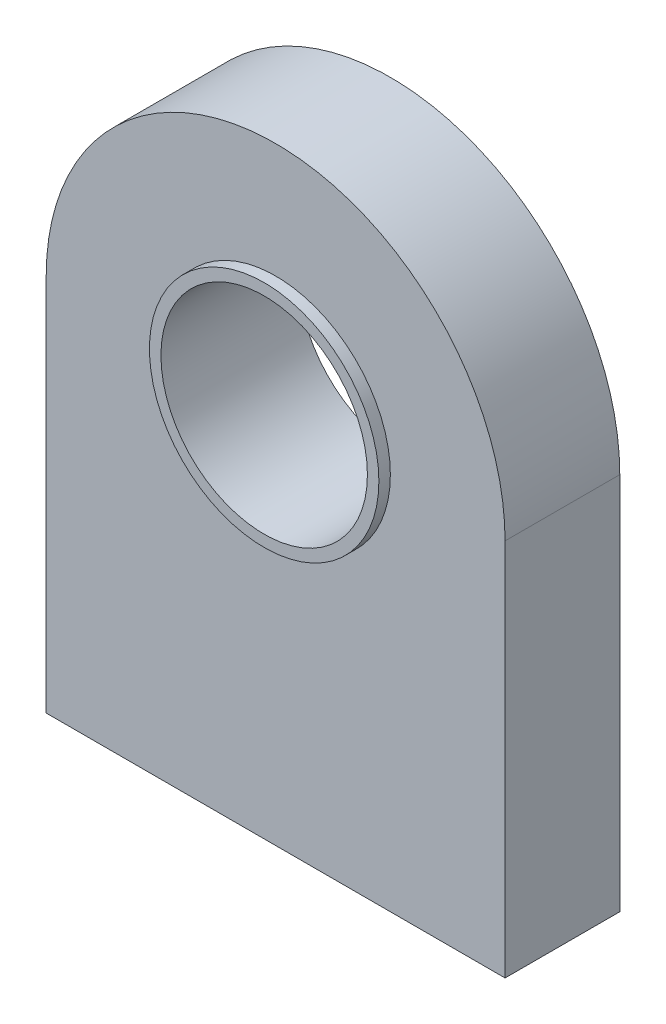
from build123d import *

# Parameters (mm, degrees)
CROQUIS1_R                   = 4.5
SALIENTE_EXTRUIR1_DEPTH      = 5
SALIENTE_EXTRUIR3_DEPTH      = 3
SALIENTE_EXTRUIR3_DEPTH_BACK = 3
CROQUIS2_R                   = 5
CROQUIS2_R_2                 = 4.5


with BuildPart() as part:
    # Croquis1 → Saliente-Extruir1 (new body)
    with BuildSketch(Plane.XY):
        with BuildLine():
            Line((0, 0), (0, 16.5))
            ThreePointArc((0, 16.5), (10, 26.5), (20, 16.5))
            Line((20, 16.5), (20, 0))
            Line((20, 0), (0, 0))
        make_face()
        with Locations((10, 16.5)):
            Circle(CROQUIS1_R, mode=Mode.SUBTRACT)
    extrude(amount=SALIENTE_EXTRUIR1_DEPTH)

    # Croquis2 → Saliente-Extruir3 (add, two sides: drawn at the far end of the back side and taken through both)
    with BuildSketch(Plane.XY.offset(2.5).offset(-SALIENTE_EXTRUIR3_DEPTH_BACK)):
        with Locations((10, 16.5)):
            Circle(CROQUIS2_R)
        with Locations((10, 16.5)):
            Circle(CROQUIS2_R_2, mode=Mode.SUBTRACT)
    extrude(amount=SALIENTE_EXTRUIR3_DEPTH + SALIENTE_EXTRUIR3_DEPTH_BACK)


solid = part.part
